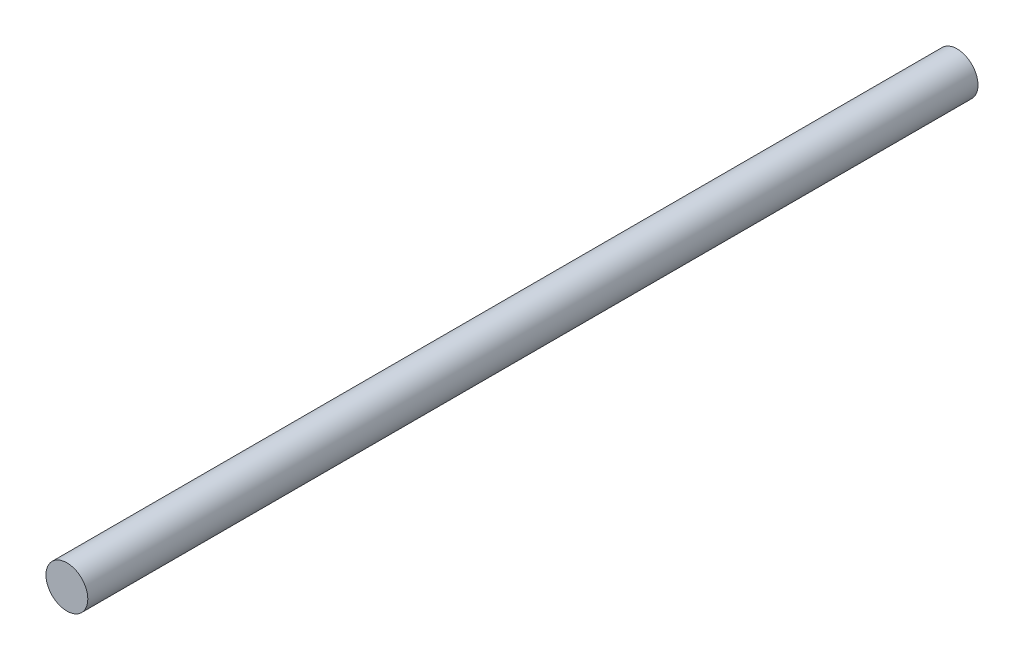
from build123d import *

# Parameters (mm, degrees)
SKETCH2_R           = 1.04
BOSS_EXTRUDE1_DEPTH = 44.23964083


with BuildPart() as part:
    # Sketch2 → Boss-Extrude1 (new body)
    with BuildSketch(Plane.XY):
        Circle(SKETCH2_R)
    extrude(amount=BOSS_EXTRUDE1_DEPTH)


solid = part.part
